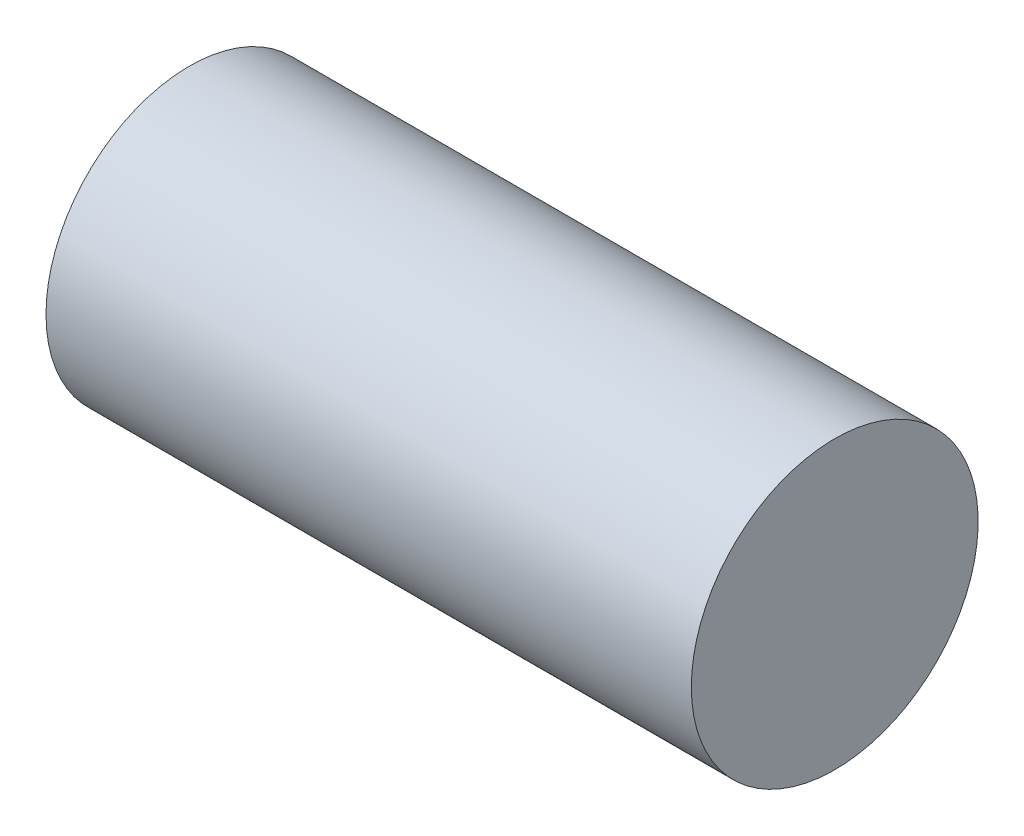
from build123d import *

# Parameters (mm, degrees)
HOSE_END_6_SKETCH_W = 45
HOSE_END_6_SKETCH_H = 10
SOCKET_1_SKETCH_W   = 17.8
SOCKET_1_SKETCH_H   = 4.7625


with BuildPart() as part:
    # Hose_End_6 Sketch → Hose_End_6 (revolve)
    with BuildSketch(Plane.XY):
        with Locations((22.5, 5)):
            Rectangle(HOSE_END_6_SKETCH_W, HOSE_END_6_SKETCH_H)
    revolve(axis=Axis((-1000, 0, 0), (1, 0, 0)))

    # Socket 1 Sketch → Socket 1 (revolve, cut)
    with BuildSketch(Plane.XY):
        with Locations((7.9, 2.38125)):
            Rectangle(SOCKET_1_SKETCH_W, SOCKET_1_SKETCH_H)
    revolve(axis=Axis((-1000, 0, 0), (1, 0, 0)), mode=Mode.SUBTRACT)


solid = part.part
